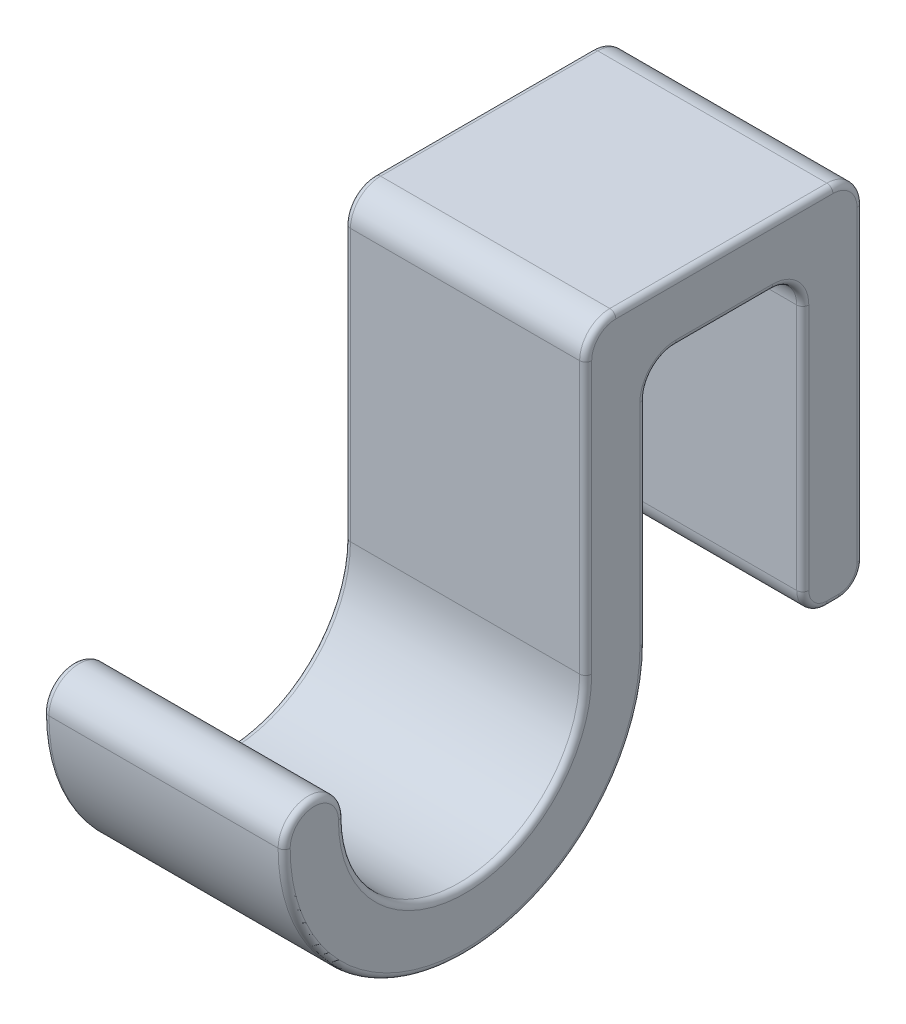
from build123d import *

# Parameters (mm, degrees)
BOSS_EXTRUDE1_DEPTH = 20
FILLET1_R           = 0.5


with BuildPart() as part:
    # Sketch1 → Boss-Extrude1 (new body)
    with BuildSketch(Plane(origin=(0, 0, 0), x_dir=(0, 0, -1), z_dir=(1, 0, 0))):
        with BuildLine():
            Line((0, 0), (0, 22.5))
            ThreePointArc((0, 22.5), (0.732233047, 24.267766953), (2.5, 25))
            Line((2.5, 25), (20.5, 25))
            ThreePointArc((20.5, 25), (22.267766953, 24.267766953), (23, 22.5))
            Line((23, 22.5), (23, -3))
            ThreePointArc((23, -3), (22.414213562, -4.414213562), (21, -5))
            Line((21, -5), (20, -5))
            ThreePointArc((20, -5), (18.585786438, -4.414213562), (18, -3))
            Line((18, -3), (18, 17.5))
            ThreePointArc((18, 17.5), (17.267766953, 19.267766953), (15.5, 20))
            Line((15.5, 20), (7.5, 20))
            ThreePointArc((7.5, 20), (5.732233047, 19.267766953), (5, 17.5))
            Line((5, 17.5), (5, 0))
            ThreePointArc((5, 0), (-10, -15), (-25, 0))
            ThreePointArc((-25, 0), (-22.5, 2.5), (-20, 0))
            ThreePointArc((-20, 0), (-10, -10), (0, 0))
        make_face()
    extrude(amount=BOSS_EXTRUDE1_DEPTH)

    # Fillet1
    fillet1_edges = [part.edges().sort_by_distance(p)[0] for p in [
        (20, 24.267766953, -0.732233047),
        (0, 2.5, 22.5),
        (0, -15, 10),
        (0, 8.75, -5),
        (20, 25, -11.5),
        (0, 19.267766953, -5.732233047),
        (0, 20, -11.5),
        (0, 19.267766953, -17.267766953),
        (0, 7.25, -18),
        (0, -4.414213562, -18.585786438),
        (0, -5, -20.5),
        (0, -4.414213562, -22.414213562),
        (0, 9.75, -23),
        (0, 24.267766953, -22.267766953),
        (0, 25, -11.5),
        (20, 24.267766953, -22.267766953),
        (0, 24.267766953, -0.732233047),
        (0, 11.25, 0),
        (0, -10, 10),
        (20, 9.75, -23),
        (20, -4.414213562, -22.414213562),
        (20, -5, -20.5),
        (20, -4.414213562, -18.585786438),
        (20, 7.25, -18),
        (20, 19.267766953, -17.267766953),
        (20, 20, -11.5),
        (20, -10, 10),
        (20, 19.267766953, -5.732233047),
        (20, 8.75, -5),
        (20, -15, 10),
        (20, 2.5, 22.5),
        (20, 11.25, 0),
    ]]
    fillet(fillet1_edges, radius=FILLET1_R)


solid = part.part
